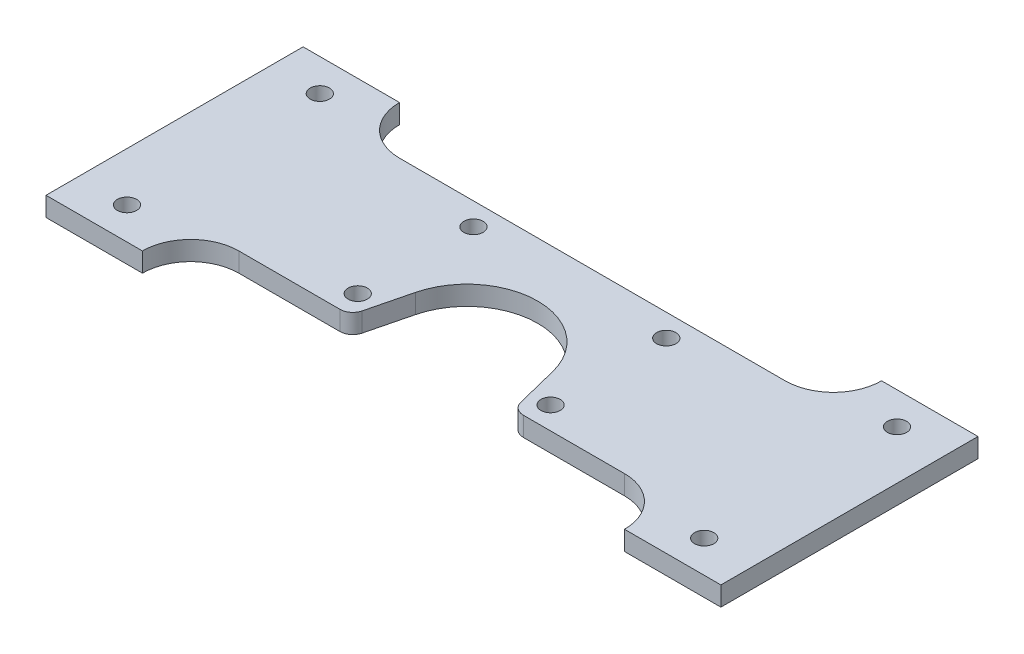
from build123d import *

# Parameters (mm, degrees)
SKETCH_1_R      = 1.5
EXTRUDE_1_DEPTH = 3
FILLET_1_R      = 2


with BuildPart() as part:
    # 草图1 → 凸台-拉伸1 (new body)
    with BuildSketch(Plane(origin=(0, 0, 0), x_dir=(1, 0, 0), z_dir=(0, 1, 0))):
        with BuildLine():
            Line((-52.5, 20), (-52.5, -20))
            Line((-52.5, -20), (-37.5, -20))
            ThreePointArc((-37.5, -20), (-35.303300859, -14.696699141), (-30, -12.5))
            Line((-30, -12.5), (-12.708053938, -12.5))
            Line((-12.708053938, -12.5), (-10.673252989, -4.338859148))
            ThreePointArc((-10.673252989, -4.338859148), (0, 4), (10.673252989, -4.338859148))
            Line((10.673252989, -4.338859148), (12.708053938, -12.5))
            Line((12.708053938, -12.5), (30, -12.5))
            ThreePointArc((30, -12.5), (35.303300859, -14.696699141), (37.5, -20))
            Line((37.5, -20), (52.5, -20))
            Line((52.5, -20), (52.5, 20))
            Line((52.5, 20), (37.5, 20))
            ThreePointArc((37.5, 20), (35.303300859, 14.696699141), (30, 12.5))
            Line((30, 12.5), (-30, 12.5))
            ThreePointArc((-30, 12.5), (-35.303300859, 14.696699141), (-37.5, 20))
            Line((-37.5, 20), (-52.5, 20))
        make_face()
        with Locations(Location((-44.901280605, 15, 0), (0, 0, 270))):
            Circle(SKETCH_1_R, mode=Mode.SUBTRACT)
        with Locations(Location((-44.901280605, -15, 0), (0, 0, 270))):
            Circle(SKETCH_1_R, mode=Mode.SUBTRACT)
        with Locations(Location((44.901280605, -15, 0), (0, 0, 270))):
            Circle(SKETCH_1_R, mode=Mode.SUBTRACT)
        with Locations(Location((44.901280605, 15, 0), (0, 0, 270))):
            Circle(SKETCH_1_R, mode=Mode.SUBTRACT)
        with Locations(Location((15, 9, 0), (0, 0, 270))):
            Circle(SKETCH_1_R, mode=Mode.SUBTRACT)
        with Locations(Location((15, -9, 0), (0, 0, 270))):
            Circle(SKETCH_1_R, mode=Mode.SUBTRACT)
        with Locations(Location((-15, 9, 0), (0, 0, 270))):
            Circle(SKETCH_1_R, mode=Mode.SUBTRACT)
        with Locations(Location((-15, -9, 0), (0, 0, 270))):
            Circle(SKETCH_1_R, mode=Mode.SUBTRACT)
    extrude(amount=EXTRUDE_1_DEPTH)

    # 圆角1
    fillet_1_edges = [part.edges().sort_by_distance(p)[0] for p in [
        (12.708053938, 1.5, 12.5),
        (-12.708053938, 1.5, 12.5),
    ]]
    fillet(fillet_1_edges, radius=FILLET_1_R)


solid = part.part
